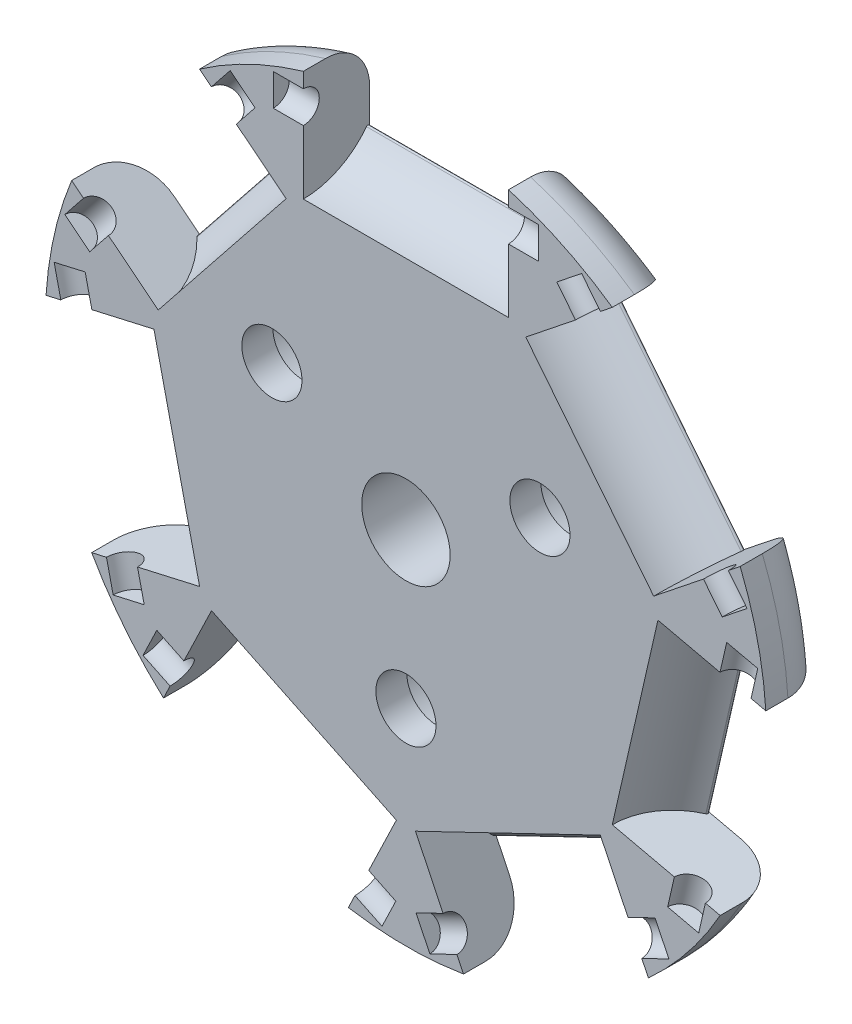
from build123d import *

# Parameters (mm, degrees)
SKETCH1_R                = 25.8953
BOSS_EXTRUDE2_DEPTH      = 4.7625
FILLET1_R                = 3.175
SKETCH2_W                = 14.732
SKETCH2_H                = 10.414
CUT_EXTRUDE2_DEPTH       = 12.7
CIRPATTERN1_COUNT        = 7
SKETCH4_R                = 1.143
CUT_EXTRUDE4_DEPTH       = 9.525
CIRPATTERN2_COUNT        = 7
SKETCH5_R                = 3.175
CUT_EXTRUDE5_DEPTH       = 37.89266219
SKETCH6_R                = 2.159
CUT_EXTRUDE7_DEPTH       = 37.89266219
SKETCH7_R                = 4.064
CUT_EXTRUDE8_DEPTH       = 2.54
BOSS_EXTRUDE4_REACH      = 44.38
FILLET2_R                = 0.127
CIRPATTERN5_COUNT        = 7
FILLET2_OF_CIRPATTERN5_R = 0.127


with BuildPart() as part:
    # Sketch1 → Boss-Extrude2 (new body)
    with BuildSketch(Plane.XY):
        Circle(SKETCH1_R)
    extrude(amount=-BOSS_EXTRUDE2_DEPTH)

    # Fillet1
    fillet1_edges = [part.edges().sort_by_distance(p)[0] for p in [
        (-25.8953, 0, -4.7625),
    ]]
    fillet(fillet1_edges, radius=FILLET1_R)

    # Sketch2 → Cut-Extrude2 (cut)
    with BuildSketch(Plane.XY):
        with Locations((0, 21.9583)):
            Rectangle(SKETCH2_W, SKETCH2_H)
    cut_extrude2 = extrude(amount=-CUT_EXTRUDE2_DEPTH, mode=Mode.SUBTRACT)

    # CirPattern1: Cut-Extrude2 ×7 about axis
    cirpattern1_axis = Axis((0, 0, 0), (0, 0, 1))
    for i in range(1, CIRPATTERN1_COUNT):
        add(cut_extrude2.rotate(cirpattern1_axis, i * 360 / CIRPATTERN1_COUNT), mode=Mode.SUBTRACT)

    # Sketch4 → Cut-Extrude4 (cut, symmetric)
    with BuildSketch(Plane(origin=(0, 0, 0), x_dir=(0, 0, -1), z_dir=(1, 0, 0))):
        with Locations((0, 22.5933)):
            Circle(SKETCH4_R)
    cut_extrude4 = extrude(amount=CUT_EXTRUDE4_DEPTH, both=True, mode=Mode.SUBTRACT)

    # CirPattern2: Cut-Extrude4 ×7 about axis
    cirpattern2_axis = Axis((0, 0, 0), (0, 0, 1))
    for i in range(1, CIRPATTERN2_COUNT):
        add(cut_extrude4.rotate(cirpattern2_axis, i * 360 / CIRPATTERN2_COUNT), mode=Mode.SUBTRACT)

    # Sketch5 → Cut-Extrude5 (cut, through all)
    with BuildSketch(Plane.XY):
        Circle(SKETCH5_R)
    extrude(amount=-CUT_EXTRUDE5_DEPTH, mode=Mode.SUBTRACT)

    # Sketch6 → Cut-Extrude7 (cut, through all)
    with BuildSketch(Plane(origin=(0, 0, -4.7625), x_dir=(-1, 0, 0), z_dir=(0, 0, -1))):
        with Locations((0, -11.1125)):
            Circle(SKETCH6_R)
        with Locations((-9.6237073, 5.55625)):
            Circle(SKETCH6_R)
        with Locations((9.6237073, 5.55625)):
            Circle(SKETCH6_R)
    extrude(amount=-CUT_EXTRUDE7_DEPTH, mode=Mode.SUBTRACT)

    # Sketch7 → Cut-Extrude8 (cut)
    with BuildSketch(Plane(origin=(0, 0, -4.7625), x_dir=(-1, 0, 0), z_dir=(0, 0, -1))):
        with Locations((9.6237073, 5.55625)):
            Circle(SKETCH7_R)
        with Locations((0, -11.1125)):
            Circle(SKETCH7_R)
        with Locations((-9.6237073, 5.55625)):
            Circle(SKETCH7_R)
    extrude(amount=-CUT_EXTRUDE8_DEPTH, mode=Mode.SUBTRACT)

    # Sketch10 → Boss-Extrude4 (add, up to next)
    with BuildSketch(Plane.ZY.offset(-7.366), mode=Mode.PRIVATE) as boss_extrude4_sk1:
        with BuildLine():
            Line((-4.7625, 16.7513), (0, 16.7513))
            Line((0, 16.7513), (0, 16.8783))
            ThreePointArc((0, 16.8783), (-2.7025038, 17.55765722), (-4.7625, 19.434214887))
            Line((-4.7625, 19.434214887), (-4.7625, 16.7513))
        make_face()
    boss_extrude4_tool1 = extrude(boss_extrude4_sk1.sketch, amount=BOSS_EXTRUDE4_REACH, mode=Mode.PRIVATE) - part.part
    boss_extrude4 = boss_extrude4_tool1.solids().sort_by_distance((7.366, 17.489807, -3.452063))[0]
    add(boss_extrude4)

    # Fillet2
    fillet2_edges = [part.edges().sort_by_distance(p)[0] for p in [
        (0, 19.434214887, -4.7625),
    ]]
    fillet(fillet2_edges, radius=FILLET2_R)

    # CirPattern5: Boss-Extrude4 ×7 about axis
    cirpattern5_axis = Axis((0, 0, 0), (0, 0, 1))
    for i in range(1, CIRPATTERN5_COUNT):
        add(boss_extrude4.rotate(cirpattern5_axis, i * 360 / CIRPATTERN5_COUNT))

    # Fillet2 of CirPattern5
    fillet2_of_cirpattern5_edges = [part.edges().sort_by_distance(p)[0] for p in [
        (-15.194281036, 12.117034789, -4.7625),
        (-18.946958545, -4.324519647, -4.7625),
        (-8.432189822, -17.509622585, -4.7625),
        (8.432189822, -17.509622585, -4.7625),
        (18.946958545, -4.324519647, -4.7625),
        (15.194281036, 12.117034789, -4.7625),
    ]]
    fillet(fillet2_of_cirpattern5_edges, radius=FILLET2_OF_CIRPATTERN5_R)


solid = part.part
